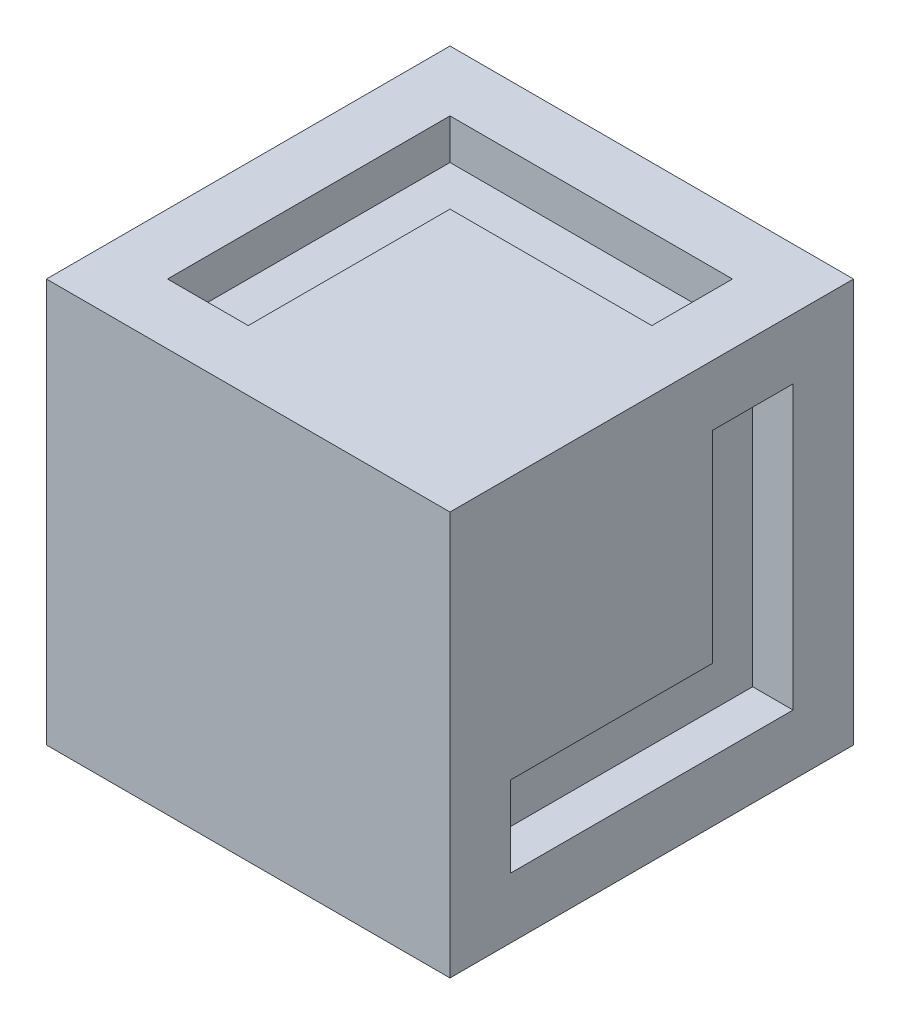
from build123d import *

# Parameters (mm, degrees)
SKETCH1_W           = 20
SKETCH1_H           = 20
BOSS_EXTRUDE1_DEPTH = 20
CUT_EXTRUDE1_DEPTH  = 2
CUT_EXTRUDE2_DEPTH  = 2
CUT_EXTRUDE3_DEPTH  = 2
CUT_EXTRUDE4_DEPTH  = 2
CUT_EXTRUDE5_DEPTH  = 2


with BuildPart() as part:
    # Sketch1 → Boss-Extrude1 (new body)
    with BuildSketch(Plane.XY.offset(5)):
        with Locations((20, 25)):
            Rectangle(SKETCH1_W, SKETCH1_H)
    extrude(amount=BOSS_EXTRUDE1_DEPTH)

    # Sketch2 → Cut-Extrude1 (cut)
    with BuildSketch(Plane(origin=(30, 0, 0), x_dir=(0, 0, -1), z_dir=(1, 0, 0))):
        Polygon((-8, 18), (-8, 32), (-12, 32), (-12, 22), (-22, 22), (-22, 18), align=None)
    extrude(amount=-CUT_EXTRUDE1_DEPTH, mode=Mode.SUBTRACT)

    # Sketch3 → Cut-Extrude2 (cut)
    with BuildSketch(Plane.ZY.offset(-10)):
        Polygon((8, 18), (8, 32), (12, 32), (12, 22), (22, 22), (22, 18), align=None)
    extrude(amount=-CUT_EXTRUDE2_DEPTH, mode=Mode.SUBTRACT)

    # Sketch4 → Cut-Extrude3 (cut)
    with BuildSketch(Plane(origin=(0, 35, 0), x_dir=(1, 0, 0), z_dir=(0, 1, 0))):
        Polygon((13, -8), (27, -8), (27, -12), (17, -12), (17, -22), (13, -22), align=None)
    extrude(amount=-CUT_EXTRUDE3_DEPTH, mode=Mode.SUBTRACT)

    # Sketch5 → Cut-Extrude4 (cut)
    with BuildSketch(Plane.XZ.offset(-15)):
        Polygon((13, 8), (27, 8), (27, 12), (17, 12), (17, 22), (13, 22), align=None)
    extrude(amount=-CUT_EXTRUDE4_DEPTH, mode=Mode.SUBTRACT)

    # Sketch6 → Cut-Extrude5 (cut)
    with BuildSketch(Plane(origin=(0, 0, 5), x_dir=(-1, 0, 0), z_dir=(0, 0, -1))):
        Polygon((-13, 18), (-27, 18), (-27, 22), (-17, 22), (-17, 32), (-13, 32), align=None)
    extrude(amount=-CUT_EXTRUDE5_DEPTH, mode=Mode.SUBTRACT)


solid = part.part
